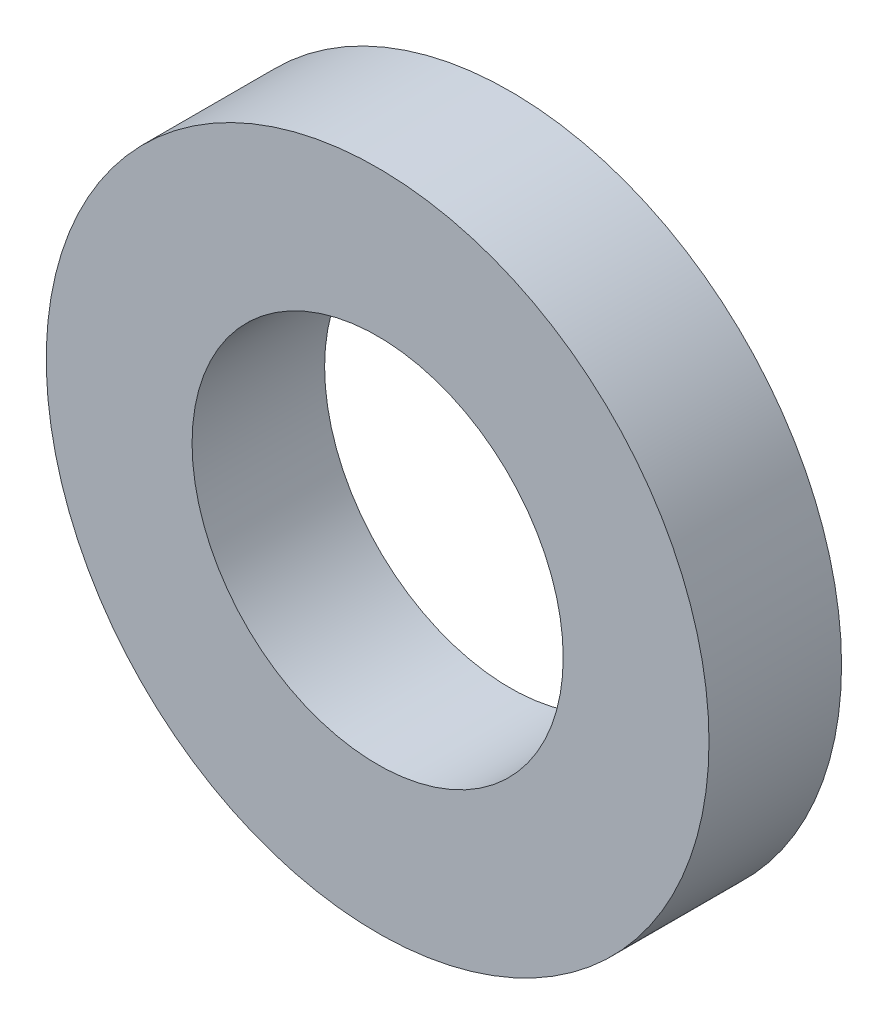
from build123d import *

# Parameters (mm, degrees)
SKETCH2_R           = 250
SKETCH2_R_2         = 140
BOSS_EXTRUDE1_DEPTH = 100


with BuildPart() as part:
    # Sketch2 → Boss-Extrude1 (new body)
    with BuildSketch(Plane.XY):
        Circle(SKETCH2_R)
        Circle(SKETCH2_R_2, mode=Mode.SUBTRACT)
    extrude(amount=BOSS_EXTRUDE1_DEPTH)


solid = part.part
